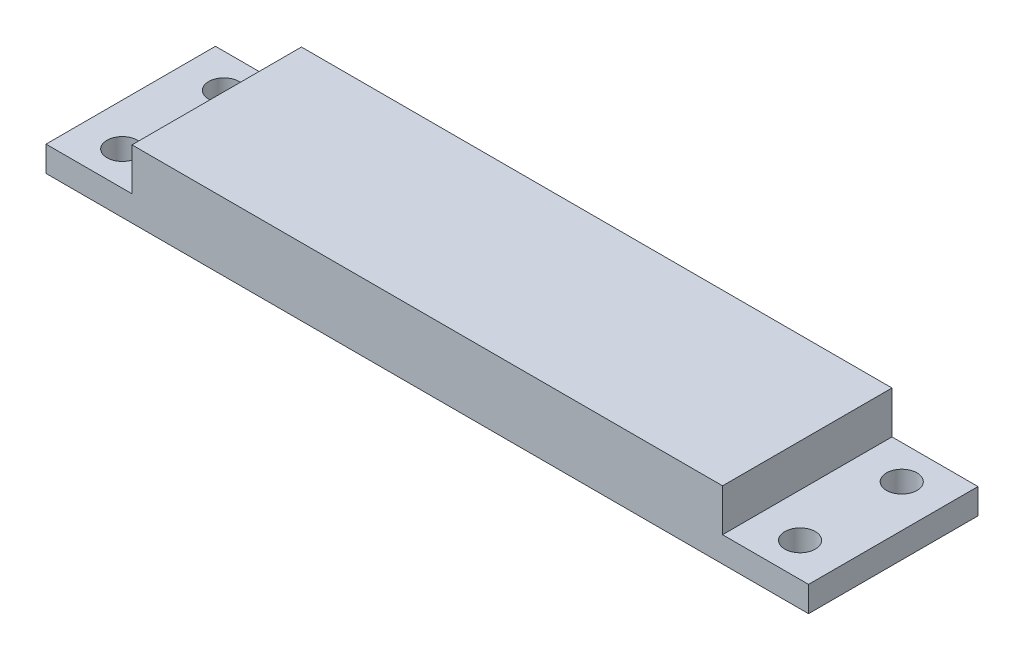
from build123d import *

# Parameters (mm, degrees)
SKETCH1_W                = 90
SKETCH1_H                = 20
BOSS_EXTRUDE1_DEPTH      = 3
SKETCH1_3_W              = 69.7
SKETCH1_3_H              = 20
BOSS_EXTRUDE2_DEPTH      = 8
M3_CLEARANCE_HOLE1_D     = 3.6
M3_CLEARANCE_HOLE1_DEPTH = 10
M3_CLEARANCE_HOLE1_TIP   = 1.081549114


with BuildPart() as part:
    # Sketch1 → Boss-Extrude1 (new body)
    with BuildSketch(Plane(origin=(0, 0, 0), x_dir=(1, 0, 0), z_dir=(0, 1, 0))):
        Rectangle(SKETCH1_W, SKETCH1_H)
    extrude(amount=BOSS_EXTRUDE1_DEPTH)

    # Sketch1<3> → Boss-Extrude2 (add)
    with BuildSketch(Plane(origin=(0, 0, 0), x_dir=(1, 0, 0), z_dir=(0, 1, 0))):
        Rectangle(SKETCH1_3_W, SKETCH1_3_H)
    extrude(amount=BOSS_EXTRUDE2_DEPTH)

    # M3 Clearance Hole1
    with Locations(Plane(origin=(0, 3, 0), x_dir=(1, 0, 0), z_dir=(0, 1, 0))):
        with Locations((-40, 6), (-40, -6), (40, -6), (40, 6)):
            Hole(M3_CLEARANCE_HOLE1_D / 2, depth=M3_CLEARANCE_HOLE1_DEPTH)
            with Locations((0, 0, -(M3_CLEARANCE_HOLE1_DEPTH + M3_CLEARANCE_HOLE1_TIP / 2))):  # 118° drill point
                Cone(0, M3_CLEARANCE_HOLE1_D / 2, M3_CLEARANCE_HOLE1_TIP, mode=Mode.SUBTRACT)


solid = part.part
